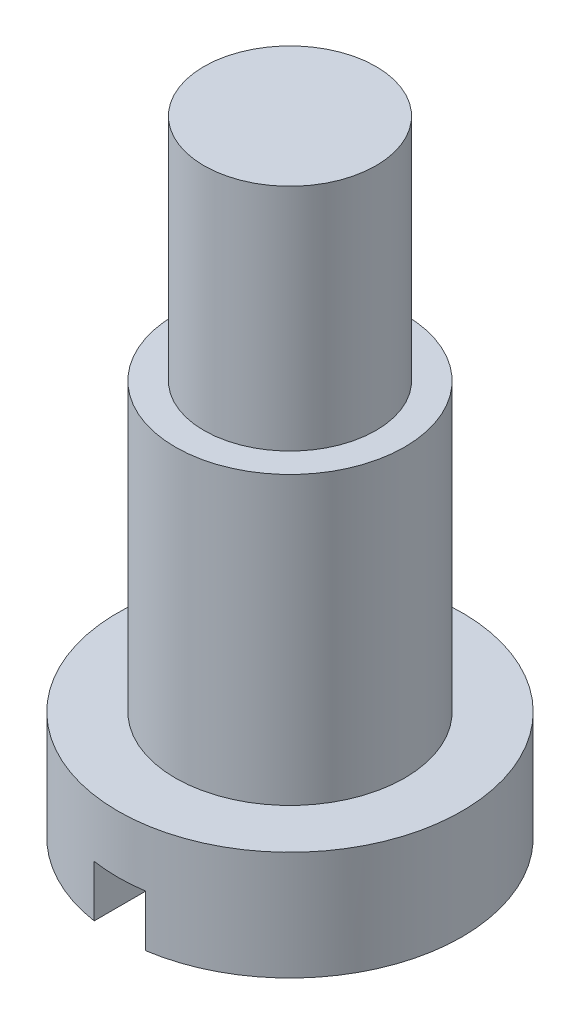
from build123d import *

# Parameters (mm, degrees)
SKETCH_1_R          = 6
EXTRUDE_1_DEPTH     = 3.8
SKETCH_2_R          = 4
EXTRUDE_2_DEPTH     = 10
SKETCH_3_R          = 3
EXTRUDE_3_DEPTH     = 8
SKETCH_4_W          = 1.8
SKETCH_4_H          = 13.920962764
CUT_EXTRUDE_1_DEPTH = 1.8


with BuildPart() as part:
    # 草图1 → 凸台-拉伸1 (new body)
    with BuildSketch(Plane(origin=(0, 0, 0), x_dir=(1, 0, 0), z_dir=(0, 1, 0))):
        with Locations(Location((0, 0, 0), (0, 0, 90))):
            Circle(SKETCH_1_R)
    extrude(amount=EXTRUDE_1_DEPTH)

    # 草图2 → 凸台-拉伸2 (add)
    with BuildSketch(Plane(origin=(0, 3.8, 0), x_dir=(1, 0, 0), z_dir=(0, 1, 0))):
        with Locations(Location((0, 0, 0), (0, 0, 270))):
            Circle(SKETCH_2_R)
    extrude(amount=EXTRUDE_2_DEPTH)

    # 草图3 → 凸台-拉伸3 (add)
    with BuildSketch(Plane(origin=(0, 13.8, 0), x_dir=(1, 0, 0), z_dir=(0, 1, 0))):
        with Locations(Location((0, 0, 0), (0, 0, 270))):
            Circle(SKETCH_3_R)
    extrude(amount=EXTRUDE_3_DEPTH)

    # 草图4 → 切除-拉伸1 (cut)
    with BuildSketch(Plane.XZ):
        Rectangle(SKETCH_4_W, SKETCH_4_H)
    extrude(amount=-CUT_EXTRUDE_1_DEPTH, mode=Mode.SUBTRACT)


solid = part.part
